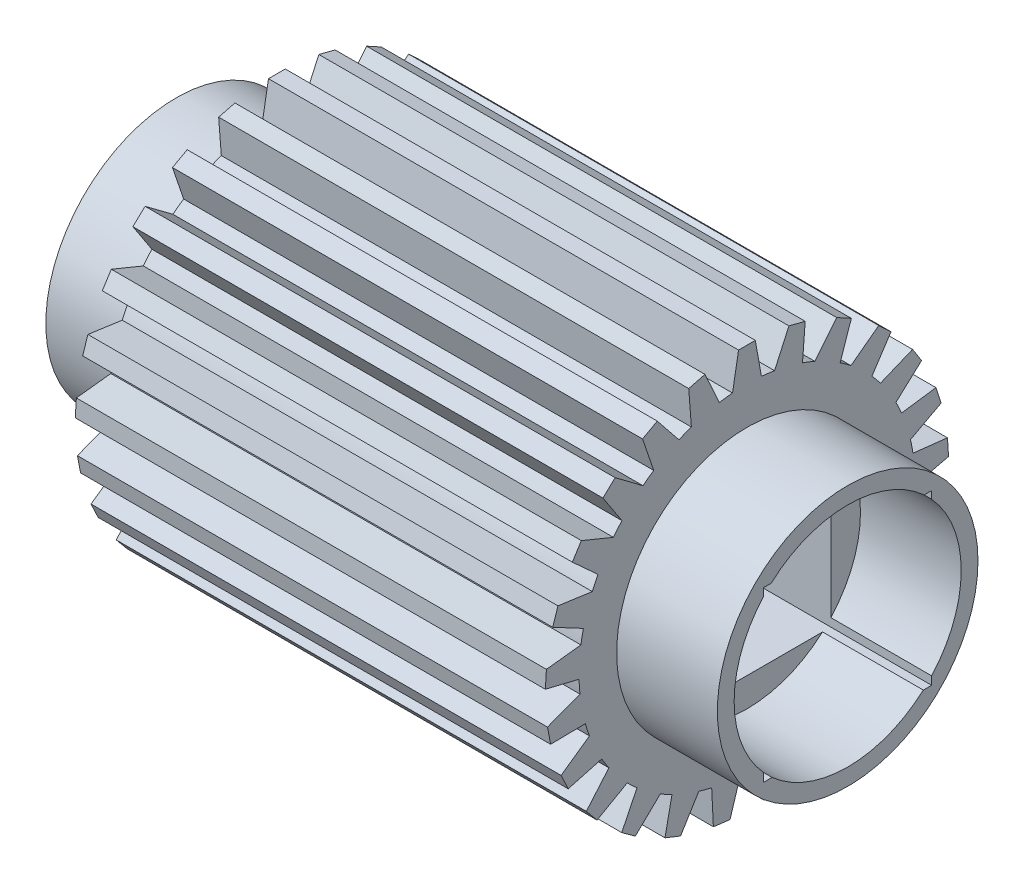
from build123d import *

# Parameters (mm, degrees)
BOSS_EXTRUDE2_START      = -9
BOSS_EXTRUDE2_DEPTH      = 14
BOSS_EXTRUDE3_DEPTH      = 5
BOSS_EXTRUDE3_DEPTH_BACK = 9
SKETCH3_R                = 5
CIRPATTERN1_COUNT        = 25
SKETCH4_W                = 5
SKETCH4_H                = 5
CUT_EXTRUDE1_DEPTH       = 18
BOSS_EXTRUDE4_DEPTH      = 3
BOSS_EXTRUDE4_DEPTH_BACK = 17
SKETCH6_R                = 3.881431072
SKETCH6_R_2              = 3.381431072
CUT_EXTRUDE2_DEPTH       = 10
CUT_EXTRUDE2_DEPTH_BACK  = 20
SKETCH7_W                = 5
SKETCH7_H                = 5.021637953


with BuildPart() as part:
    # Sketch2 → Boss-Extrude2 (new body)
    with BuildSketch(Plane(origin=(0, 0, 0), x_dir=(0, 0, -1), z_dir=(1, 0, 0)).offset(BOSS_EXTRUDE2_START)):
        with BuildLine():
            ThreePointArc((0.429587035, 4.981511315), (0, 5), (-0.429587035, 4.981511315))
            Line((-0.429587035, 4.981511315), (-0.700772987, 3.443539352))
            Line((-0.700772987, 3.443539352), (0.700772987, 3.443539352))
            Line((0.700772987, 3.443539352), (0.429587035, 4.981511315))
        make_face()
        with BuildLine():
            Line((0.25, 6), (-0.25, 6))
            Line((-0.25, 6), (-0.429587035, 4.981511315))
            ThreePointArc((-0.429587035, 4.981511315), (0, 5), (0.429587035, 4.981511315))
            Line((0.429587035, 4.981511315), (0.25, 6))
        make_face()
    boss_extrude2 = extrude(amount=BOSS_EXTRUDE2_DEPTH)

    # Sketch3 → Boss-Extrude3 (add, two sides: drawn at the far end of the back side and taken through both)
    with BuildSketch(Plane(origin=(0, 0, 0), x_dir=(0, 0, -1), z_dir=(1, 0, 0)).offset(-BOSS_EXTRUDE3_DEPTH_BACK)):
        Circle(SKETCH3_R)
    extrude(amount=BOSS_EXTRUDE3_DEPTH + BOSS_EXTRUDE3_DEPTH_BACK)

    # CirPattern1: Boss-Extrude2 ×25 about axis
    cirpattern1_axis = Axis((0, 0, 0), (1, 0, 0))
    for i in range(1, CIRPATTERN1_COUNT):
        add(boss_extrude2.rotate(cirpattern1_axis, i * 360 / CIRPATTERN1_COUNT))

    # Sketch4 → Cut-Extrude1 (cut)
    with BuildSketch(Plane(origin=(5, 0, 0), x_dir=(0, 0, -1), z_dir=(1, 0, 0))):
        Rectangle(SKETCH4_W, SKETCH4_H)
    extrude(amount=-CUT_EXTRUDE1_DEPTH, mode=Mode.SUBTRACT)

    # Sketch6 → Boss-Extrude4 (add, two sides: drawn at the far end of the back side and taken through both)
    with BuildSketch(Plane(origin=(5, 0, 0), x_dir=(0, 0, -1), z_dir=(1, 0, 0)).offset(-BOSS_EXTRUDE4_DEPTH_BACK)):
        Circle(SKETCH6_R)
        Circle(SKETCH6_R_2, mode=Mode.SUBTRACT)
    extrude(amount=BOSS_EXTRUDE4_DEPTH + BOSS_EXTRUDE4_DEPTH_BACK)

    # Sketch7 → Cut-Extrude2 (cut, two sides: drawn at the far end of the back side and taken through both)
    with BuildSketch(Plane(origin=(5, 0, 0), x_dir=(0, 0, -1), z_dir=(1, 0, 0)).offset(-CUT_EXTRUDE2_DEPTH_BACK)):
        with Locations((0, -0.010818977)):
            Rectangle(SKETCH7_W, SKETCH7_H)
    extrude(amount=CUT_EXTRUDE2_DEPTH + CUT_EXTRUDE2_DEPTH_BACK, mode=Mode.SUBTRACT)


solid = part.part
